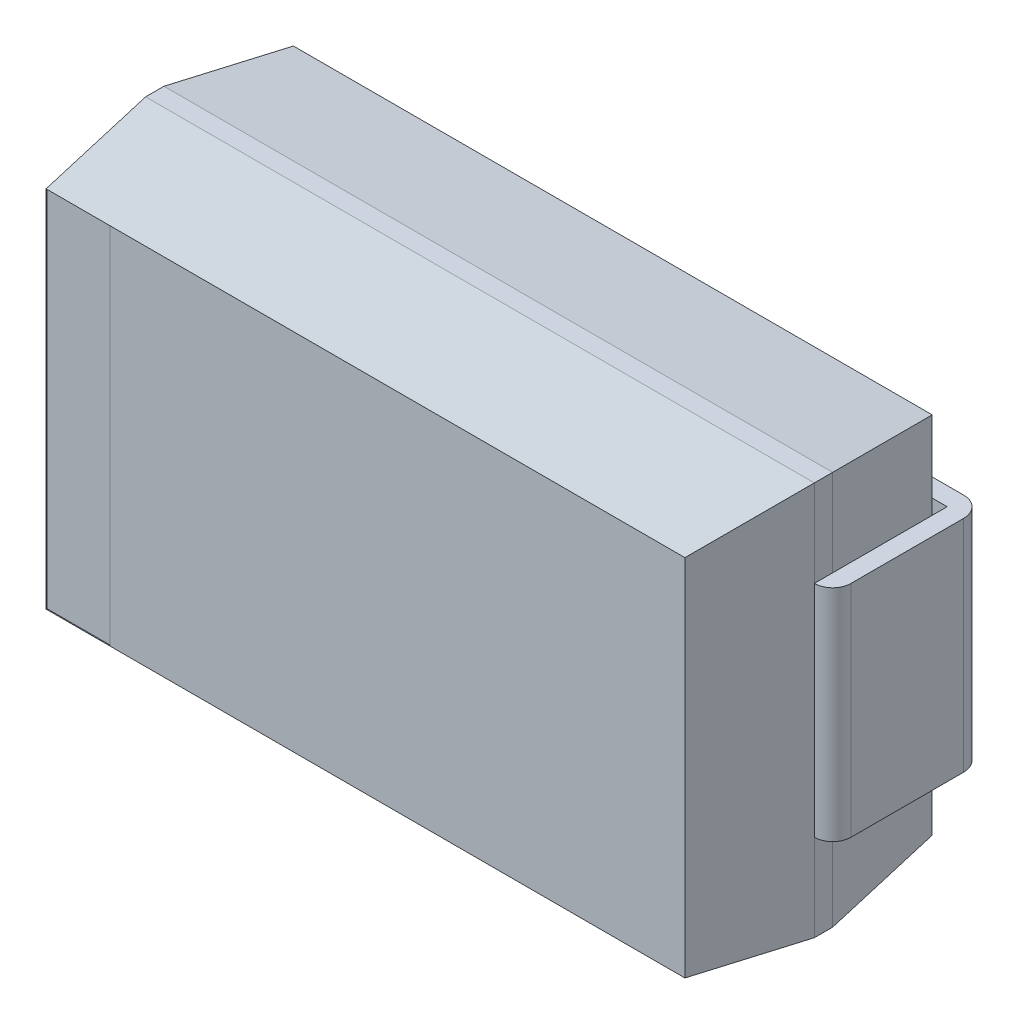
from build123d import *
from OCP.BRepFilletAPI import BRepFilletAPI_MakeChamfer

# Parameters (mm, degrees)
SKETCH_1_W           = 7.3
SKETCH_1_H           = 4.3
EXTRUDE_1_DEPTH      = 2.7
CHAMFER_1_SIZE       = 1.25
CHAMFER_1_SIZE2      = 0.163
CHAMFER_2_SIZE       = 0.163
CHAMFER_2_SIZE2      = 1.25
EXTRUDE_2_DEPTH      = 1.2
EXTRUDE_2_DEPTH_BACK = 1.2
SKETCH_3_W           = 0.7
SKETCH_3_H           = 3.974
CUT_EXTRUDE_1_DEPTH  = 0.01


with BuildPart() as part:
    # Эскиз1 → Бобышка-Вытянуть1 (new body)
    with BuildSketch(Plane.XY.offset(0.2)):
        Rectangle(SKETCH_1_W, SKETCH_1_H)
    extrude(amount=EXTRUDE_1_DEPTH)

    # Фаска1: one chamfer whose edges measure the first distance from different faces: ONE call of the kernel's chamfer builder (chamfer() names one face for all edges)
    chamfer_1_edges_1 = [part.edges().sort_by_distance(p)[0] for p in [
        (-3.65, 0, 2.9),
    ]]
    chamfer_1_side_1 = [part.faces().sort_by_distance(p)[0] for p in [
        (-3.65, 0, 1.55),
    ]]
    chamfer_1_edges_2 = [part.edges().sort_by_distance(p)[0] for p in [
        (0, -2.15, 2.9),
    ]]
    chamfer_1_side_2 = [part.faces().sort_by_distance(p)[0] for p in [
        (0, -2.15, 1.55),
    ]]
    chamfer_1_edges_3 = [part.edges().sort_by_distance(p)[0] for p in [
        (3.65, 0, 2.9),
    ]]
    chamfer_1_side_3 = [part.faces().sort_by_distance(p)[0] for p in [
        (3.65, 0, 1.55),
    ]]
    chamfer_1_edges_4 = [part.edges().sort_by_distance(p)[0] for p in [
        (0, 2.15, 2.9),
    ]]
    chamfer_1_side_4 = [part.faces().sort_by_distance(p)[0] for p in [
        (0, 2.15, 1.55),
    ]]
    chamfer_1 = BRepFilletAPI_MakeChamfer(part.part.solid().wrapped)
    for e in chamfer_1_edges_1:
        chamfer_1.Add(CHAMFER_1_SIZE, CHAMFER_1_SIZE2, e.wrapped, chamfer_1_side_1[0].wrapped)  # the first distance lies on this face
    for e in chamfer_1_edges_2:
        chamfer_1.Add(CHAMFER_1_SIZE, CHAMFER_1_SIZE2, e.wrapped, chamfer_1_side_2[0].wrapped)  # the first distance lies on this face
    for e in chamfer_1_edges_3:
        chamfer_1.Add(CHAMFER_1_SIZE, CHAMFER_1_SIZE2, e.wrapped, chamfer_1_side_3[0].wrapped)  # the first distance lies on this face
    for e in chamfer_1_edges_4:
        chamfer_1.Add(CHAMFER_1_SIZE, CHAMFER_1_SIZE2, e.wrapped, chamfer_1_side_4[0].wrapped)  # the first distance lies on this face
    add(Compound.cast(chamfer_1.Shape()), mode=Mode.REPLACE)

    # Фаска2
    chamfer_2_edges = [part.edges().sort_by_distance(p)[0] for p in [
        (0, -2.15, 0.2),
        (-3.65, 0, 0.2),
        (0, 2.15, 0.2),
        (3.65, 0, 0.2),
    ]]
    chamfer_2_side = [part.faces().sort_by_distance(p)[0] for p in [
        (0, 0, 0.2),
    ]]
    chamfer(chamfer_2_edges, length=CHAMFER_2_SIZE, length2=CHAMFER_2_SIZE2, reference=chamfer_2_side[0])

    # Эскиз3 → Вырез-Вытянуть1 (cut)
    with BuildSketch(Plane.XY.offset(2.9)):
        with Locations((-3.137, 0)):
            Rectangle(SKETCH_3_W, SKETCH_3_H)
    extrude(amount=-CUT_EXTRUDE_1_DEPTH, mode=Mode.SUBTRACT)


with BuildPart() as body_2:
    # Эскиз2 → Бобышка-Вытянуть2 (new, two sides: drawn at the far end of the back side and taken through both)
    with BuildSketch(Plane(origin=(0, 0, 0), x_dir=(1, 0, 0), z_dir=(0, 1, 0)).offset(-EXTRUDE_2_DEPTH_BACK)):
        with BuildLine():
            Line((-3.65, -0.2), (-3.65, -1.45))
            Line((-3.65, -1.45), (-3.65, -1.65))
            ThreePointArc((-3.65, -1.65), (-3.791421356, -1.591421356), (-3.85, -1.45))
            Line((-3.85, -1.45), (-3.85, -0.22))
            ThreePointArc((-3.85, -0.22), (-3.785563492, -0.064436508), (-3.63, 0))
            Line((-3.63, 0), (-2.55, 0))
            Line((-2.55, 0), (-2.55, -0.2))
            Line((-2.55, -0.2), (-3.65, -0.2))
        make_face()
    extrude(amount=EXTRUDE_2_DEPTH + EXTRUDE_2_DEPTH_BACK)


with BuildPart() as body_3:
    # Зеркальное отражение1: mirrored copy
    add(body_2.part.mirror(Plane(origin=(0, 0, 0), x_dir=(0, 0, 1), z_dir=(1, 0, 0))))


solid = Compound([part.part, body_2.part, body_3.part])
